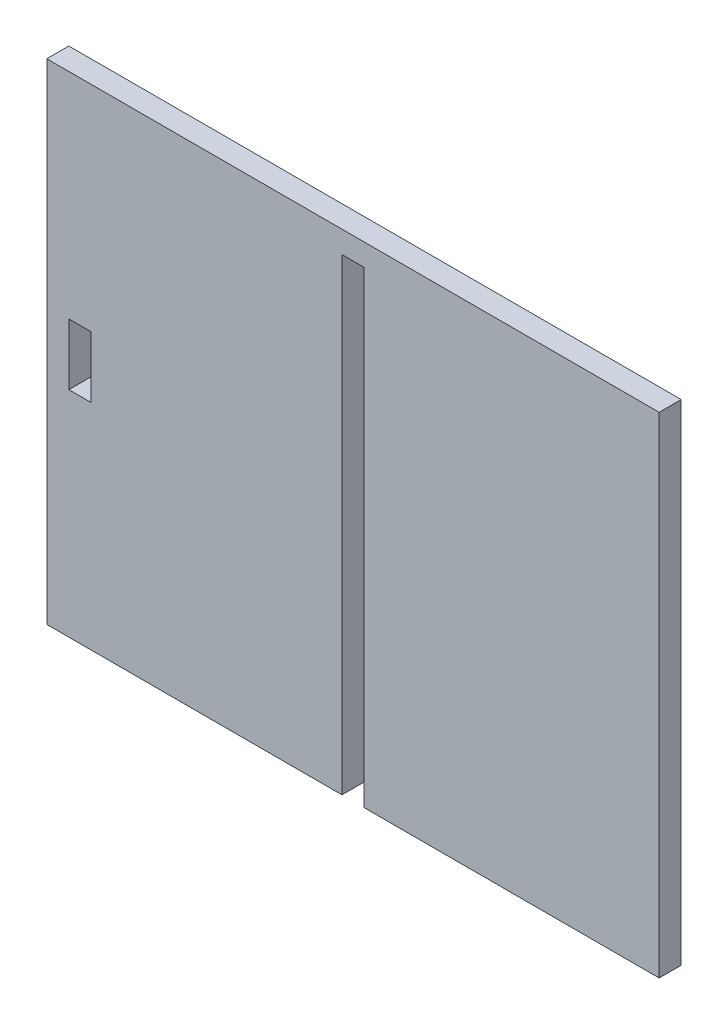
from build123d import *

# Parameters (mm, degrees)
SKETCH1_W           = 18
SKETCH1_H           = 50
BOSS_EXTRUDE1_DEPTH = 18


with BuildPart() as part:
    # Sketch1 → Boss-Extrude1 (new body)
    with BuildSketch(Plane.XY):
        Polygon((2.231655058, -200), (243.231655058, -200), (243.231655058, 200), (-256.768344942, 200), (-256.768344942, -200), (-15.768344942, -200), (-15.768344942, 182), (2.231655058, 182), align=None)
        with Locations((-229.768344942, 0)):
            Rectangle(SKETCH1_W, SKETCH1_H, mode=Mode.SUBTRACT)
    extrude(amount=BOSS_EXTRUDE1_DEPTH)


solid = part.part
